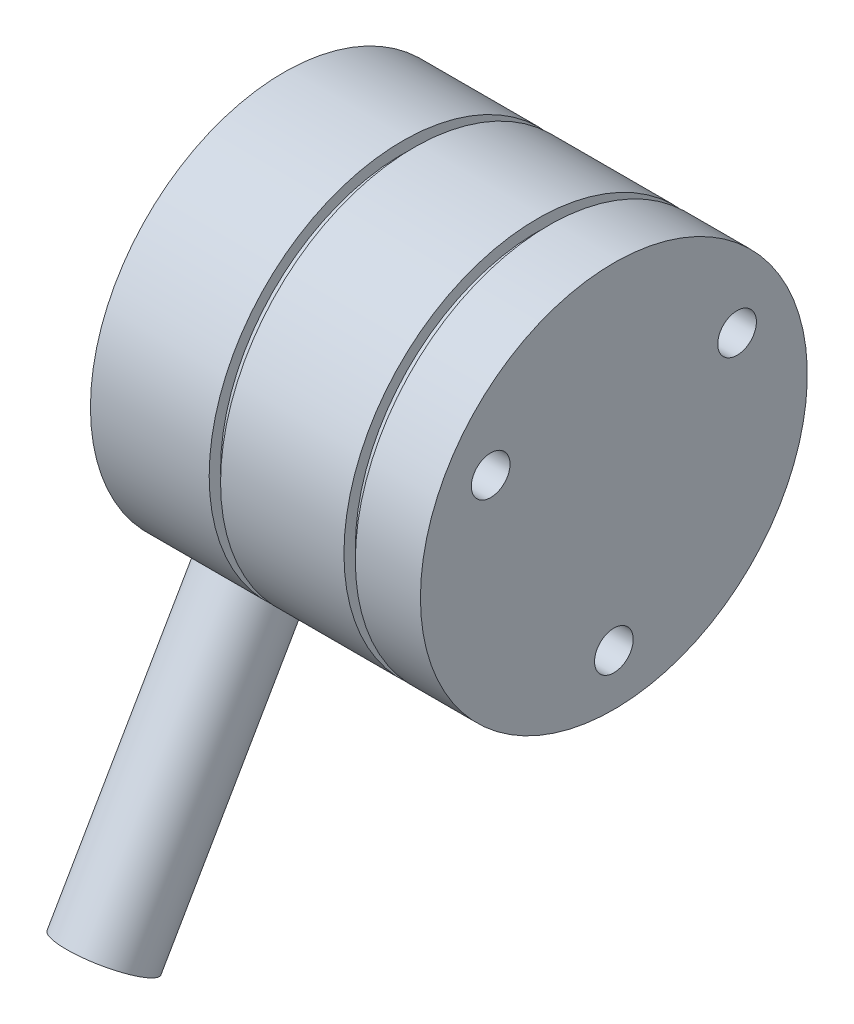
from build123d import *

# Parameters (mm, degrees)
SKETCH2_R                = 0.85
CUT_EXTRUDE1_DEPTH       = 2.54
BOSS_EXTRUDE1_DEPTH      = 12.7
BOSS_EXTRUDE1_DEPTH_BACK = 2.54
SKETCH3_R                = 1.9
SKETCH4_R                = 0.85
CUT_EXTRUDE2_DEPTH       = 2.794


with BuildPart() as part:
    # Sketch1 → Revolve1 (revolve)
    with BuildSketch(Plane.XY, mode=Mode.PRIVATE) as revolve1_sk:
        Polygon((0, 0), (0, 8.5), (5.21775571, 8.5), (5.21775571, 8), (5.71775571, 8), (5.71775571, 8.5), (11.139308543, 8.5), (11.139308543, 8), (11.639308543, 8), (11.639308543, 8.5), (14.5, 8.5), (14.5, 0), align=None)
    revolve(revolve1_sk.sketch.rotate(Axis((0, 0, 0), (1, 0, 0)), 90), axis=Axis((0, 0, 0), (1, 0, 0)))

    # Sketch2 → Cut-Extrude1 (cut)
    with BuildSketch(Plane.ZY):
        with Locations((-2.641364136, 5.664423669)):
            Circle(SKETCH2_R)
        with Locations((6.226216863, -0.544723392)):
            Circle(SKETCH2_R)
        with Locations((-3.584852727, -5.119700277)):
            Circle(SKETCH2_R)
    extrude(amount=-CUT_EXTRUDE1_DEPTH, mode=Mode.SUBTRACT)

    # Sketch3 → Boss-Extrude1 (add, two sides: drawn at the far end of the back side and taken through both)
    with BuildSketch(Plane(origin=(0, -7.361215932, 4.25), x_dir=(1, 0, 0), z_dir=(0, -0.8660254037844398, 0.499999999999998)).offset(-BOSS_EXTRUDE1_DEPTH_BACK)):
        with Locations(Location((2.694505782, 0, 0), (0, 0, 270))):
            Circle(SKETCH3_R)
    extrude(amount=BOSS_EXTRUDE1_DEPTH + BOSS_EXTRUDE1_DEPTH_BACK)

    # Sketch4 → Cut-Extrude2 (cut)
    with BuildSketch(Plane(origin=(14.5, 0, 0), x_dir=(0, 0, -1), z_dir=(1, 0, 0))):
        with Locations((0, -6.25)):
            Circle(SKETCH4_R)
        with Locations((-5.412658774, 3.125)):
            Circle(SKETCH4_R)
        with Locations((5.412658774, 3.125)):
            Circle(SKETCH4_R)
    extrude(amount=-CUT_EXTRUDE2_DEPTH, mode=Mode.SUBTRACT)


solid = part.part
